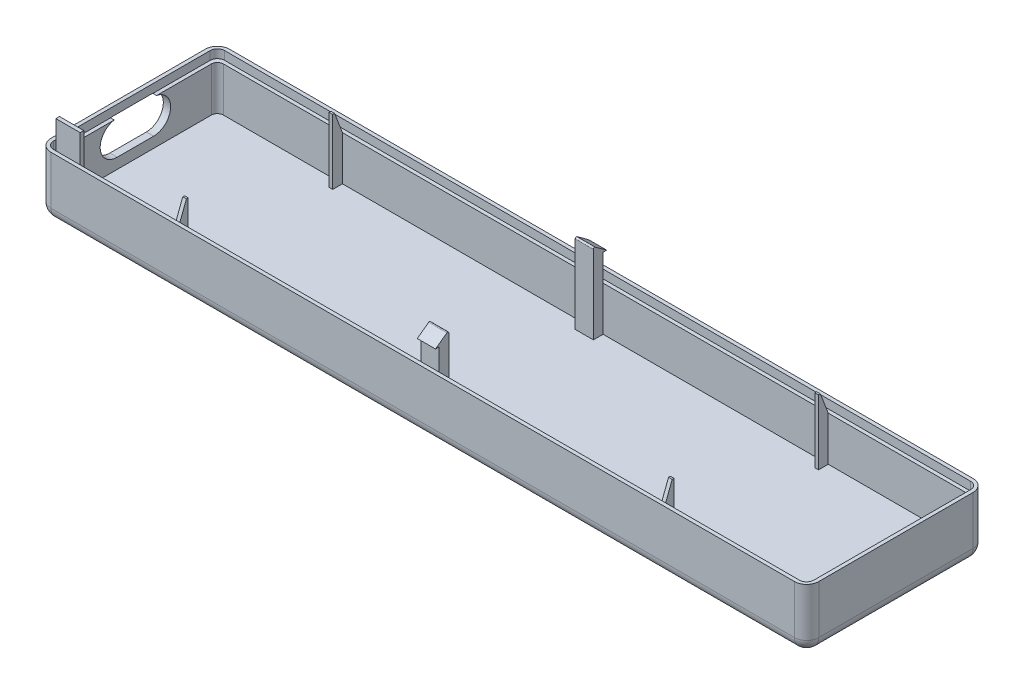
from build123d import *

# Parameters (mm, degrees)
SKETCH1_W            = 160.5788
SKETCH1_H            = 37.338
BOSS_EXTRUDE1_DEPTH  = 12.7
SKETCH2_W            = 157.5308
SKETCH2_H            = 34.29
CUT_EXTRUDE3_DEPTH   = 11.049
FILLET1_R            = 2.54
FILLET2_R            = 1.27
CUT_EXTRUDE4_REACH   = 164.158
SKETCH4_W            = 159.0548
SKETCH4_H            = 35.814
CUT_EXTRUDE5_DEPTH   = 1.778
FILLET3_R            = 1.524
SKETCH5_W            = 5.08
SKETCH5_H            = 0.762
BOSS_EXTRUDE2_DEPTH  = 7.62
SKETCH6_W            = 0.762
SKETCH6_H            = 2.032
BOSS_EXTRUDE3_DEPTH  = 13.589
LPATTERN1_COUNT      = 2
LPATTERN1_PITCH      = 101.6
LPATTERN1_COUNT_DIR2 = 2
LPATTERN1_PITCH_DIR2 = 32.258
CUT_EXTRUDE6_REACH   = 133.936
SKETCH8_W            = 3.81
SKETCH8_H            = 2.032
BOSS_EXTRUDE4_DEPTH  = 14.859
BOSS_EXTRUDE9_DEPTH  = 3.81
FILLET4_R            = 0.254
FILLET4_OF_MIRROR2_R = 0.254


with BuildPart() as part:
    # Sketch1 → Boss-Extrude1 (new body)
    with BuildSketch(Plane(origin=(0, 0, 0), x_dir=(1, 0, 0), z_dir=(0, 1, 0))):
        Rectangle(SKETCH1_W, SKETCH1_H)
    extrude(amount=BOSS_EXTRUDE1_DEPTH)

    # Sketch2 → Cut-Extrude3 (cut)
    with BuildSketch(Plane(origin=(0, 12.7, 0), x_dir=(1, 0, 0), z_dir=(0, 1, 0))):
        Rectangle(SKETCH2_W, SKETCH2_H)
    extrude(amount=-CUT_EXTRUDE3_DEPTH, mode=Mode.SUBTRACT)

    # Fillet1
    fillet1_edges = [part.edges().sort_by_distance(p)[0] for p in [
        (0, 0, 18.669),
        (-80.2894, 0, 0),
        (0, 0, -18.669),
        (80.2894, 0, 0),
        (80.2894, 6.35, 18.669),
        (-80.2894, 6.35, 18.669),
        (-80.2894, 6.35, -18.669),
        (80.2894, 6.35, -18.669),
    ]]
    fillet(fillet1_edges, radius=FILLET1_R)

    # Fillet2
    fillet2_edges = [part.edges().sort_by_distance(p)[0] for p in [
        (-78.7654, 7.1755, -17.145),
        (-78.7654, 7.1755, 17.145),
        (78.7654, 7.1755, 17.145),
        (78.7654, 7.1755, -17.145),
    ]]
    fillet(fillet2_edges, radius=FILLET2_R)

    # Sketch3 → Cut-Extrude4 (cut, up to next)
    with BuildSketch(Plane.ZY.offset(80.2894), mode=Mode.PRIVATE) as cut_extrude4_sk1:
        with BuildLine():
            Line((3.81, 3.8633146), (-3.81, 3.8633146))
            ThreePointArc((-3.81, 3.8633146), (-7.366, 7.4193146), (-3.81, 10.9753146))
            Line((-3.81, 10.9753146), (3.81, 10.9753146))
            ThreePointArc((3.81, 10.9753146), (7.366, 7.4193146), (3.81, 3.8633146))
        make_face()
    cut_extrude4_tool1 = extrude(cut_extrude4_sk1.sketch, amount=-CUT_EXTRUDE4_REACH, mode=Mode.PRIVATE) & part.part
    add(cut_extrude4_tool1.solids().sort_by_distance((-80.2894, 7.419315, 0))[0], mode=Mode.SUBTRACT)

    # Sketch4 → Cut-Extrude5 (cut)
    with BuildSketch(Plane(origin=(0, 12.7, 0), x_dir=(1, 0, 0), z_dir=(0, 1, 0))):
        Rectangle(SKETCH4_W, SKETCH4_H)
    extrude(amount=-CUT_EXTRUDE5_DEPTH, mode=Mode.SUBTRACT)

    # Fillet3
    fillet3_edges = [part.edges().sort_by_distance(p)[0] for p in [
        (-79.5274, 11.811, 17.907),
        (-79.5274, 11.811, -17.907),
        (79.5274, 11.811, -17.907),
        (79.5274, 11.811, 17.907),
    ]]
    fillet(fillet3_edges, radius=FILLET3_R)

    # Sketch5 → Boss-Extrude2 (add)
    with BuildSketch(Plane(origin=(0, 10.922, 0), x_dir=(1, 0, 0), z_dir=(0, 1, 0))):
        with Locations((-74.9554, -17.526)):
            Rectangle(SKETCH5_W, SKETCH5_H)
    extrude(amount=BOSS_EXTRUDE2_DEPTH)

    # Sketch6 → Boss-Extrude3 (add)
    with BuildSketch(Plane(origin=(0, 1.651, 0), x_dir=(1, 0, 0), z_dir=(0, 1, 0))):
        with Locations((-52.9844, 16.129)):
            Rectangle(SKETCH6_W, SKETCH6_H)
    boss_extrude3 = extrude(amount=BOSS_EXTRUDE3_DEPTH)

    # LPattern1: Boss-Extrude3 2 × 2
    with Locations(*[(i * LPATTERN1_PITCH, 0, j * LPATTERN1_PITCH_DIR2) for i in range(LPATTERN1_COUNT) for j in range(LPATTERN1_COUNT_DIR2) if (i, j) != (0, 0)]):
        add(boss_extrude3)

    # Cut-Extrude6: up to this face of the body (flat: up to its plane)
    cut_extrude6_end = Plane(part.part.faces().sort_by_distance((-53.3654, 8.4455, -16.129))[0])
    # Sketch7 → Cut-Extrude6 (cut, up to the picked face)
    with BuildSketch(Plane(origin=(48.9966, 0, 0), x_dir=(0, 0, -1), z_dir=(1, 0, 0)), mode=Mode.PRIVATE) as cut_extrude6_sk1:
        Polygon((17.145, 10.922), (15.494, 15.24), (17.145, 15.24), align=None)
    cut_extrude6_tool1 = split(extrude(cut_extrude6_sk1.sketch, amount=-CUT_EXTRUDE6_REACH, mode=Mode.PRIVATE), bisect_by=cut_extrude6_end, keep=Keep.BOTH, mode=Mode.PRIVATE)
    cut_extrude6 = cut_extrude6_tool1.solids().sort_by(Axis((48.9966, 13.800667, -16.594667), (-1, 0, 0)))[0]
    add(cut_extrude6, mode=Mode.SUBTRACT)

    # Mirror1: Cut-Extrude6 across plane
    add(cut_extrude6.mirror(Plane.XY), mode=Mode.SUBTRACT)

    # Sketch8 → Boss-Extrude4 (add)
    with BuildSketch(Plane(origin=(0, 1.651, 0), x_dir=(1, 0, 0), z_dir=(0, 1, 0))):
        with Locations((0, -16.129)):
            Rectangle(SKETCH8_W, SKETCH8_H)
        with Locations((0, 16.129)):
            Rectangle(SKETCH8_W, SKETCH8_H)
    extrude(amount=BOSS_EXTRUDE4_DEPTH)

    # Sketch9 → Boss-Extrude9 (add)
    with BuildSketch(Plane(origin=(1.905, 0, 0), x_dir=(0, 0, -1), z_dir=(1, 0, 0))):
        Polygon((-15.113, 16.51), (-17.907, 16.51), (-15.113, 18.542), align=None)
    boss_extrude9 = extrude(amount=-BOSS_EXTRUDE9_DEPTH)

    # Fillet4
    fillet4_edges = [part.edges().sort_by_distance(p)[0] for p in [
        (0, 18.542, 15.113),
    ]]
    fillet(fillet4_edges, radius=FILLET4_R)

    # Mirror2: Boss-Extrude9 across plane
    add(boss_extrude9.mirror(Plane.XY))

    # Fillet4 of Mirror2
    fillet4_of_mirror2_edges = [part.edges().sort_by_distance(p)[0] for p in [
        (0, 18.542, -15.113),
    ]]
    fillet(fillet4_of_mirror2_edges, radius=FILLET4_OF_MIRROR2_R)


solid = part.part
